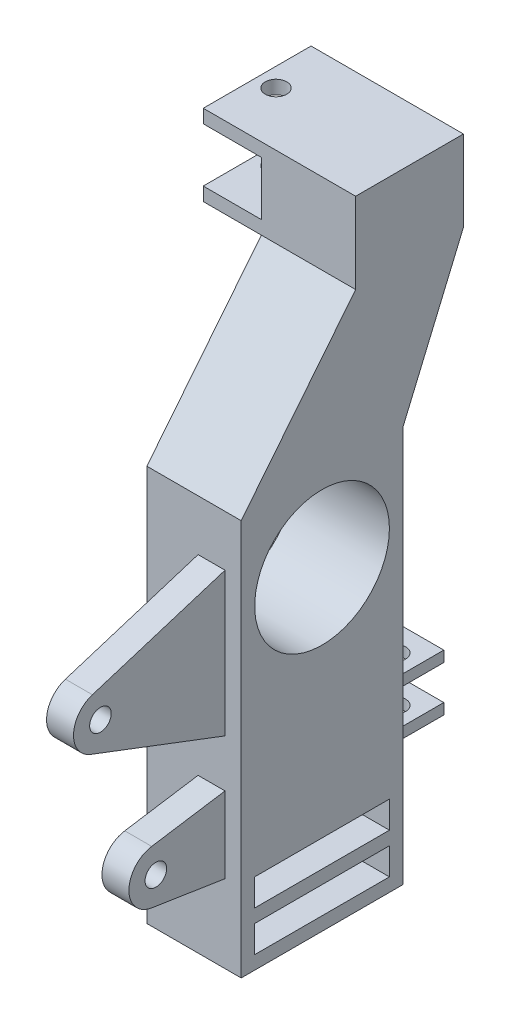
from build123d import *

# Parameters (mm, degrees)
BOSS_EXTRUDE1_DEPTH      = 28
BOSS_EXTRUDE1_DEPTH_BACK = 7
SKETCH1_R                = 25
SKETCH1_W                = 50
SKETCH1_H                = 10
SKETCH3_W                = 21.546368229
SKETCH3_H                = 5
BOSS_EXTRUDE2_DEPTH      = 40
CUT_EXTRUDE1_DEPTH       = 238.629693409
CUT_EXTRUDE1_DEPTH_BACK  = 40
SKETCH4_R                = 4
SKETCH5_R                = 4
CUT_EXTRUDE2_DEPTH       = 25
SKETCH6_W                = 15.192054263
SKETCH6_H                = 4
BOSS_EXTRUDE4_DEPTH      = 35
SKETCH7_R                = 4
CUT_EXTRUDE3_DEPTH       = 35
BOSS_EXTRUDE5_DEPTH      = 5
BOSS_EXTRUDE5_DEPTH_BACK = 5
SKETCH8_R                = 4


with BuildPart() as part:
    # Sketch1 → Boss-Extrude1 (new, two sides: drawn at the far end of the back side and taken through both)
    # profile 1 of 3: a face of its own
    with BuildSketch(Plane(origin=(0, 0, 0), x_dir=(0, 0, -1), z_dir=(1, 0, 0)).offset(-BOSS_EXTRUDE1_DEPTH_BACK)):
        Polygon((12.468810267, 220), (12.468810267, 190), (52.468810267, 190), (52.468810267, 205), (52.468810267, 220), align=None)
    # profile 2 of 3: a face of its own
    with BuildSketch(Plane(origin=(0, 0, 0), x_dir=(0, 0, -1), z_dir=(1, 0, 0)).offset(-BOSS_EXTRUDE1_DEPTH_BACK)):
        Polygon((12.468810267, 190), (52.468810267, 190), (30, 136.969027383), (-30, 136.969027383), align=None)
    # profile 3 of 3: a face of its own
    with BuildSketch(Plane(origin=(0, 0, 0), x_dir=(0, 0, -1), z_dir=(1, 0, 0)).offset(-BOSS_EXTRUDE1_DEPTH_BACK)):
        Polygon((-30, 136.969027383), (30, 136.969027383), (30, 106.969027383), (30, 10), (30, -10), (-30, -10), (-30, 10), (-30, 106.969027383), align=None)
        with Locations((0, 106.969027383)):
            Circle(SKETCH1_R, mode=Mode.SUBTRACT)
        Polygon((-25, 20), (-25, 10), (0, 10), (25, 10), (25, 20), align=None, mode=Mode.SUBTRACT)
        Rectangle(SKETCH1_W, SKETCH1_H, mode=Mode.SUBTRACT)
    extrude(amount=BOSS_EXTRUDE1_DEPTH + BOSS_EXTRUDE1_DEPTH_BACK)

    # Sketch3 → Boss-Extrude2 (add)
    with BuildSketch(Plane(origin=(0, 0, -52.468810267), x_dir=(-1, 0, 0), z_dir=(0, 0, -1))):
        with Locations((17.773184115, 192.5)):
            Rectangle(SKETCH3_W, SKETCH3_H)
        with Locations((17.773184115, 217.5)):
            Rectangle(SKETCH3_W, SKETCH3_H)
    extrude(amount=-BOSS_EXTRUDE2_DEPTH)

    # Sketch4 → Cut-Extrude1 (cut, two sides: drawn at the far end of the back side and taken through both)
    with BuildSketch(Plane(origin=(0, 220, 0), x_dir=(1, 0, 0), z_dir=(0, 1, 0)).offset(-CUT_EXTRUDE1_DEPTH_BACK)):
        with Locations(Location((-21.546368229, 32.468810267, 0), (0, 0, 90))):
            Circle(SKETCH4_R)
    extrude(amount=CUT_EXTRUDE1_DEPTH + CUT_EXTRUDE1_DEPTH_BACK, mode=Mode.SUBTRACT)

    # Sketch5 → Cut-Extrude2 (cut)
    with BuildSketch(Plane.XZ.offset(10)):
        with Locations(Location((0, 0, 0), (0, 0, 270))):
            Circle(SKETCH5_R)
    extrude(amount=-CUT_EXTRUDE2_DEPTH, mode=Mode.SUBTRACT)

    # Sketch6 → Boss-Extrude4 (add)
    with BuildSketch(Plane(origin=(0, 0, -30), x_dir=(-1, 0, 0), z_dir=(0, 0, -1))):
        with Locations((-0.596027132, 35.974427815)):
            Rectangle(SKETCH6_W, SKETCH6_H)
        with Locations((-0.596027132, 19.121539986)):
            Rectangle(SKETCH6_W, SKETCH6_H)
    extrude(amount=BOSS_EXTRUDE4_DEPTH)

    # Sketch7 → Cut-Extrude3 (cut)
    with BuildSketch(Plane.XZ.offset(-17.121539986)):
        with Locations(Location((0, -55, 0), (0, 0, 270))):
            Circle(SKETCH7_R)
    extrude(amount=-CUT_EXTRUDE3_DEPTH, mode=Mode.SUBTRACT)

    # Sketch8 → Boss-Extrude5 (add, two sides: drawn at the far end of the back side and taken through both)
    # profile 1 of 2: a face of its own
    with BuildSketch(Plane(origin=(17, 0, 0), x_dir=(0, 0, -1), z_dir=(1, 0, 0)).offset(-BOSS_EXTRUDE5_DEPTH_BACK)):
        with BuildLine():
            Line((-30, 118.060328993), (-30, 64.802844314))
            Line((-30, 64.802844314), (-79.782583008, 83.7497926))
            ThreePointArc((-79.782583008, 83.7497926), (-86.221055725, 93.395743584), (-79.215750464, 102.638254039))
            Line((-79.215750464, 102.638254039), (-30, 118.060328993))
        make_face()
        with Locations((-76.225555525, 93.095784012)):
            Circle(SKETCH8_R, mode=Mode.SUBTRACT)
    # profile 2 of 2: a face of its own
    with BuildSketch(Plane(origin=(17, 0, 0), x_dir=(0, 0, -1), z_dir=(1, 0, 0)).offset(-BOSS_EXTRUDE5_DEPTH_BACK)):
        with BuildLine():
            Line((-30, 47.125470645), (-30, 18.906005285))
            Line((-30, 18.906005285), (-57.203314441, 23.134394747))
            ThreePointArc((-57.203314441, 23.134394747), (-65.667392499, 33.015737965), (-57.203314441, 42.897081183))
            Line((-57.203314441, 42.897081183), (-30, 47.125470645))
        make_face()
        with Locations((-55.667392499, 33.015737965)):
            Circle(SKETCH8_R, mode=Mode.SUBTRACT)
    extrude(amount=BOSS_EXTRUDE5_DEPTH + BOSS_EXTRUDE5_DEPTH_BACK)


solid = part.part
